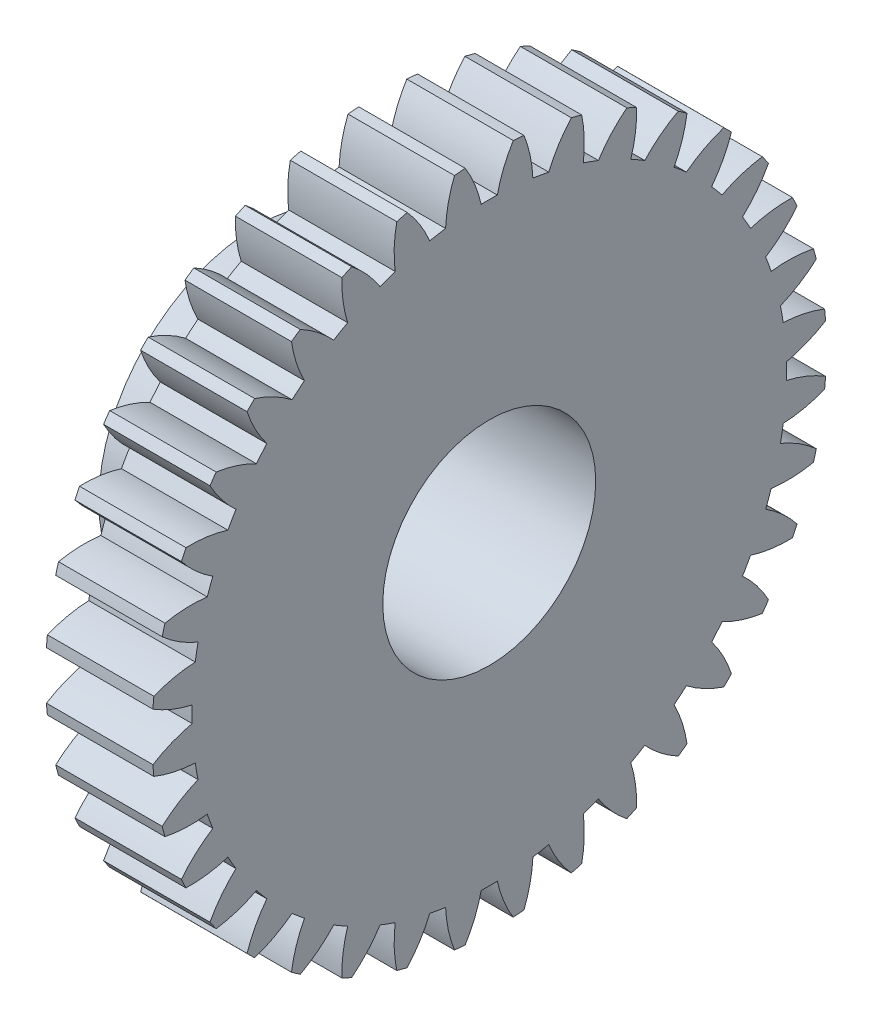
from build123d import *

# Parameters (mm, degrees)
BASPROSKE_W        = 3
BASPROSKE_H        = 9.5
TOOTHCUT_DEPTH     = 14.765899898
TEETHCUTS_COUNT    = 36
HUBNEAONESKE_R     = 4.5
HUBNEARONE_DEPTH   = 3.5000508
BORSKE_R           = 3
BORE_DEPTH         = 6.5000508
SKETCH3_R          = 1.25
CUT_EXTRUDE1_DEPTH = 5


with BuildPart() as part:
    # BasProSke → Base-Revolve (revolve)
    with BuildSketch(Plane(origin=(0, 0, 0), x_dir=(1, 0, 0), z_dir=(0, 1, 0)), mode=Mode.PRIVATE) as base_revolve_sk:
        with Locations((1.5, 4.75)):
            Rectangle(BASPROSKE_W, BASPROSKE_H)
    revolve(base_revolve_sk.sketch.rotate(Axis((-10, 0, 0), (1, 0, 0)), 180), axis=Axis((-10, 0, 0), (1, 0, 0)))

    # TooCutSke → ToothCut (cut, through all)
    with BuildSketch(Plane(origin=(0, 0, 0), x_dir=(0, 0, -1), z_dir=(1, 0, 0))):
        with BuildLine():
            ThreePointArc((0.227221176, 8.370916708), (0, 8.374), (-0.227221176, 8.370916708))
            ThreePointArc((-0.227221176, 8.370916708), (-0.411410437, 8.955426484), (-0.69207336, 9.500225241))
            ThreePointArc((-0.69207336, 9.500225241), (0, 9.5254), (0.69207336, 9.500225241))
            ThreePointArc((0.69207336, 9.500225241), (0.411410437, 8.955426484), (0.227221176, 8.370916708))
        make_face()
    toothcut = extrude(amount=TOOTHCUT_DEPTH, mode=Mode.SUBTRACT)

    # TeethCuts: ToothCut ×36 about axis
    teethcuts_axis = Axis((0, 0, 0), (1, 0, 0))
    for i in range(1, TEETHCUTS_COUNT):
        add(toothcut.rotate(teethcuts_axis, i * 360 / TEETHCUTS_COUNT), mode=Mode.SUBTRACT)

    # HubNeaOneSke → HubNearOne (add)
    with BuildSketch(Plane.ZY):
        with Locations(Location((0, 0, 0), (0, 0, 180))):
            Circle(HUBNEAONESKE_R)
    extrude(amount=HUBNEARONE_DEPTH)

    # BorSke → Bore (cut, symmetric)
    with BuildSketch(Plane(origin=(0, 0, 0), x_dir=(0, 0, -1), z_dir=(1, 0, 0))):
        with Locations(Location((0, 0, 0), (0, 0, 180))):
            Circle(BORSKE_R)
    extrude(amount=BORE_DEPTH, both=True, mode=Mode.SUBTRACT)

    # Sketch3 → Cut-Extrude1 (cut, symmetric)
    with BuildSketch(Plane.XY):
        with Locations((-1.7500508, 0)):
            Circle(SKETCH3_R)
    extrude(amount=CUT_EXTRUDE1_DEPTH, both=True, mode=Mode.SUBTRACT)


solid = part.part
